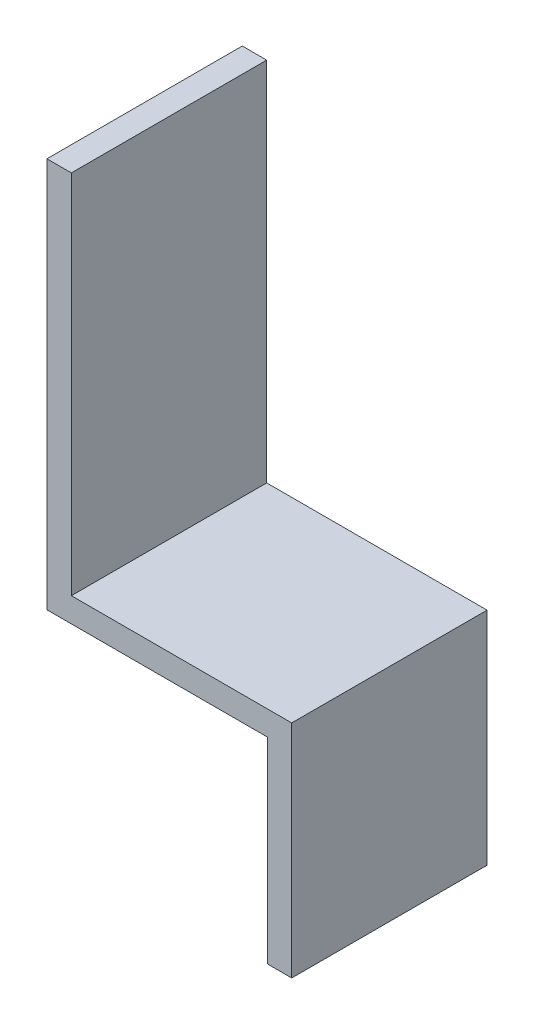
from build123d import *

# Parameters (mm, degrees)
BOSS_EXTRUDE1_DEPTH = 25.4


with BuildPart() as part:
    # Sketch1 → Boss-Extrude1 (new body)
    with BuildSketch(Plane.XY):
        Polygon((39.283846791, -34.38375344), (39.283846791, -5.659868516), (10.632177225, -5.659868516), (10.632177225, 41.952612442), (7.457177225, 41.952612442), (7.457177225, -8.834868516), (36.108846791, -8.834868516), (36.108846791, -34.38375344), align=None)
    extrude(amount=BOSS_EXTRUDE1_DEPTH)


solid = part.part
